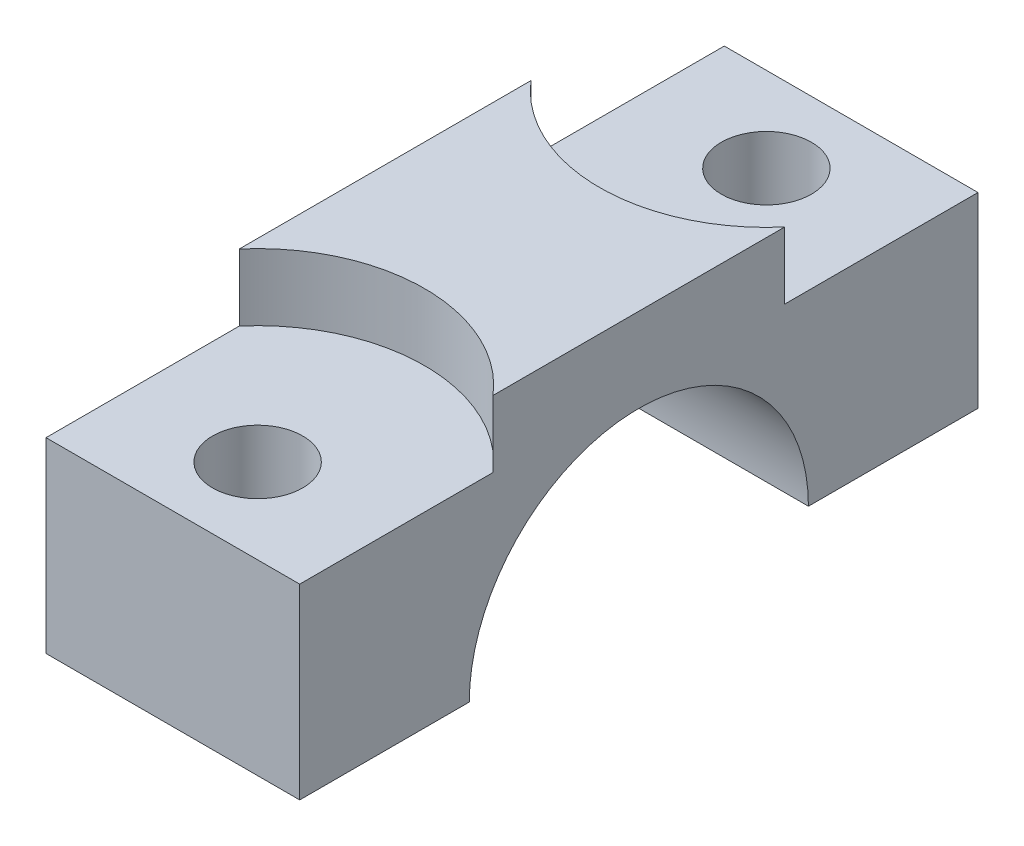
from build123d import *

# Parameters (mm, degrees)
BOSS_EXTRUDE1_DEPTH                                  = 9.5
CBORE_FOR_M12_HEX_HEAD_CAP_SCREW3_D                  = 6.75
CBORE_FOR_M12_HEX_HEAD_CAP_SCREW3_CBORE_D            = 25
CBORE_FOR_M12_HEX_HEAD_CAP_SCREW3_CBORE_DEPTH        = 5
CBORE_FOR_M12_HEX_HEAD_CAP_SCREW3_ON_FAC_D           = 6.75
CBORE_FOR_M12_HEX_HEAD_CAP_SCREW3_ON_FAC_CBORE_D     = 25
CBORE_FOR_M12_HEX_HEAD_CAP_SCREW3_ON_FAC_CBORE_DEPTH = 5


with BuildPart() as part:
    # Sketch1 → Boss-Extrude1 (new, symmetric)
    with BuildSketch(Plane(origin=(0, 0, 0), x_dir=(0, 0, -1), z_dir=(1, 0, 0))):
        with BuildLine():
            Line((12.7, 0), (25.4, 0))
            Line((25.4, 0), (25.4, 19))
            Line((25.4, 19), (-25.4, 19))
            Line((-25.4, 19), (-25.4, 0))
            Line((-25.4, 0), (-12.7, 0))
            ThreePointArc((-12.7, 0), (0, 12.7), (12.7, 0))
        make_face()
    extrude(amount=BOSS_EXTRUDE1_DEPTH, both=True)

    # CBORE for M12 Hex Head Cap Screw3 (through all)
    with Locations(Plane(origin=(0, 19, -19.05), x_dir=(0, 0, 1), z_dir=(0, 1, 0))):
        with Locations((0, 0), (38.1, 0)):
            CounterBoreHole(CBORE_FOR_M12_HEX_HEAD_CAP_SCREW3_D / 2, CBORE_FOR_M12_HEX_HEAD_CAP_SCREW3_CBORE_D / 2, CBORE_FOR_M12_HEX_HEAD_CAP_SCREW3_CBORE_DEPTH)

    # CBORE for M12 Hex Head Cap Screw3 on fac (through all)
    with Locations(Plane(origin=(-110.222321175, 0, -2.324723696), x_dir=(0, 0, 1), z_dir=(0, 1, 0))):
        with Locations((0, 0)):
            CounterBoreHole(CBORE_FOR_M12_HEX_HEAD_CAP_SCREW3_ON_FAC_D / 2, CBORE_FOR_M12_HEX_HEAD_CAP_SCREW3_ON_FAC_CBORE_D / 2, CBORE_FOR_M12_HEX_HEAD_CAP_SCREW3_ON_FAC_CBORE_DEPTH)


solid = part.part
